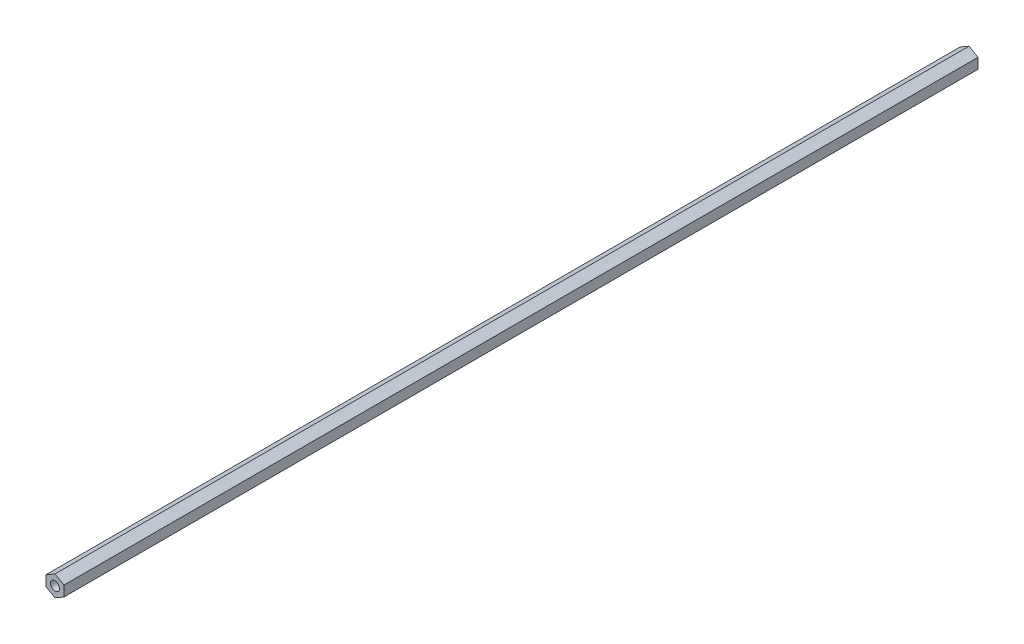
from build123d import *

# Parameters (mm, degrees)
BOSS_EXTRUDE2_DEPTH             = 323.85
BOSS_EXTRUDE2_DEPTH_BACK        = 323.85
F_1_4_0_25_DIAMETER_HOLE1_D     = 6.35
F_1_4_0_25_DIAMETER_HOLE1_DEPTH = 25.4
F_1_4_0_25_DIAMETER_HOLE1_TIP   = 1.907732465
F_1_4_0_25_DIAMETER_HOLE2_D     = 6.35
F_1_4_0_25_DIAMETER_HOLE2_DEPTH = 25.4
F_1_4_0_25_DIAMETER_HOLE2_TIP   = 1.907732465


with BuildPart() as part:
    # Sketch3 → Boss-Extrude2 (new, two sides: drawn at the far end of the back side and taken through both)
    with BuildSketch(Plane.XY.offset(-BOSS_EXTRUDE2_DEPTH_BACK)):
        Polygon((-6.35, -3.666174209), (0, -7.332348419), (6.35, -3.666174209), (6.35, 3.666174209), (0, 7.332348419), (-6.35, 3.666174209), align=None)
    extrude(amount=BOSS_EXTRUDE2_DEPTH + BOSS_EXTRUDE2_DEPTH_BACK)

    # 1/4 (0.25) Diameter Hole1
    with Locations(Plane.XY.offset(323.85)):
        with Locations((0, 0)):
            Hole(F_1_4_0_25_DIAMETER_HOLE1_D / 2, depth=F_1_4_0_25_DIAMETER_HOLE1_DEPTH)
            with Locations((0, 0, -(F_1_4_0_25_DIAMETER_HOLE1_DEPTH + F_1_4_0_25_DIAMETER_HOLE1_TIP / 2))):  # 118° drill point
                Cone(0, F_1_4_0_25_DIAMETER_HOLE1_D / 2, F_1_4_0_25_DIAMETER_HOLE1_TIP, mode=Mode.SUBTRACT)

    # 1/4 (0.25) Diameter Hole2
    with Locations(Plane(origin=(0, 0, -323.85), x_dir=(-1, 0, 0), z_dir=(0, 0, -1))):
        with Locations((0, 0)):
            Hole(F_1_4_0_25_DIAMETER_HOLE2_D / 2, depth=F_1_4_0_25_DIAMETER_HOLE2_DEPTH)
            with Locations((0, 0, -(F_1_4_0_25_DIAMETER_HOLE2_DEPTH + F_1_4_0_25_DIAMETER_HOLE2_TIP / 2))):  # 118° drill point
                Cone(0, F_1_4_0_25_DIAMETER_HOLE2_D / 2, F_1_4_0_25_DIAMETER_HOLE2_TIP, mode=Mode.SUBTRACT)


solid = part.part
